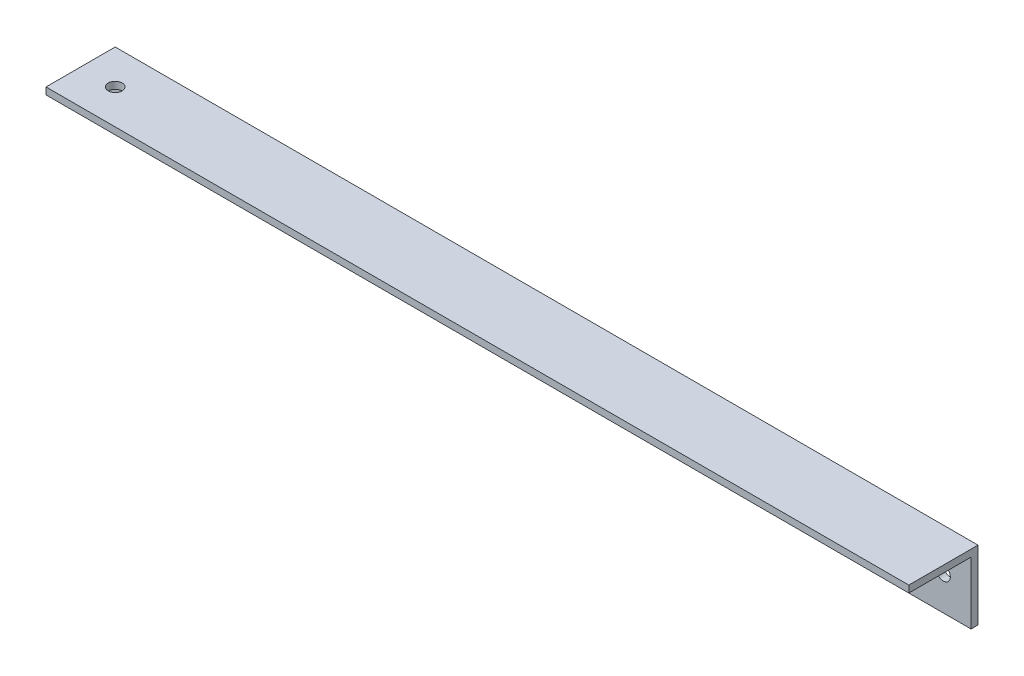
from build123d import *

# Parameters (mm, degrees)
ESQUISSE1_W      = 187
ESQUISSE1_H      = 15
ESQUISSE1_R      = 1.5
EXTRUSION1_DEPTH = 1.5
ESQUISSE3_W      = 187
ESQUISSE3_H      = 1.5
EXTRUSION3_DEPTH = 13.5
ESQUISSE4_R      = 1.5
EXTRUSION4_DEPTH = 10


with BuildPart() as part:
    # Esquisse1 → Extrusion1 (new body)
    with BuildSketch(Plane.XY):
        with Locations((13.570945199, 9.544736842)):
            Rectangle(ESQUISSE1_W, ESQUISSE1_H)
        with Locations((101.070945199, 9.544736842)):
            Circle(ESQUISSE1_R, mode=Mode.SUBTRACT)
        with Locations((-72.429054801, 8.044736842)):
            Circle(ESQUISSE1_R, mode=Mode.SUBTRACT)
        with Locations((-31.429054801, 8.044736842)):
            Circle(ESQUISSE1_R, mode=Mode.SUBTRACT)
        with Locations((68.570945199, 8.044736842)):
            Circle(ESQUISSE1_R, mode=Mode.SUBTRACT)
    extrude(amount=EXTRUSION1_DEPTH)

    # Esquisse3 → Extrusion3 (add)
    with BuildSketch(Plane.XY.offset(1.5)):
        with Locations((13.570945199, 16.294736842)):
            Rectangle(ESQUISSE3_W, ESQUISSE3_H)
    extrude(amount=EXTRUSION3_DEPTH)

    # Esquisse4 → Extrusion4 (cut)
    with BuildSketch(Plane.XZ.offset(-15.544736842)):
        with Locations((-72.429054801, 7.5)):
            Circle(ESQUISSE4_R)
    extrude(amount=-EXTRUSION4_DEPTH, mode=Mode.SUBTRACT)


solid = part.part
